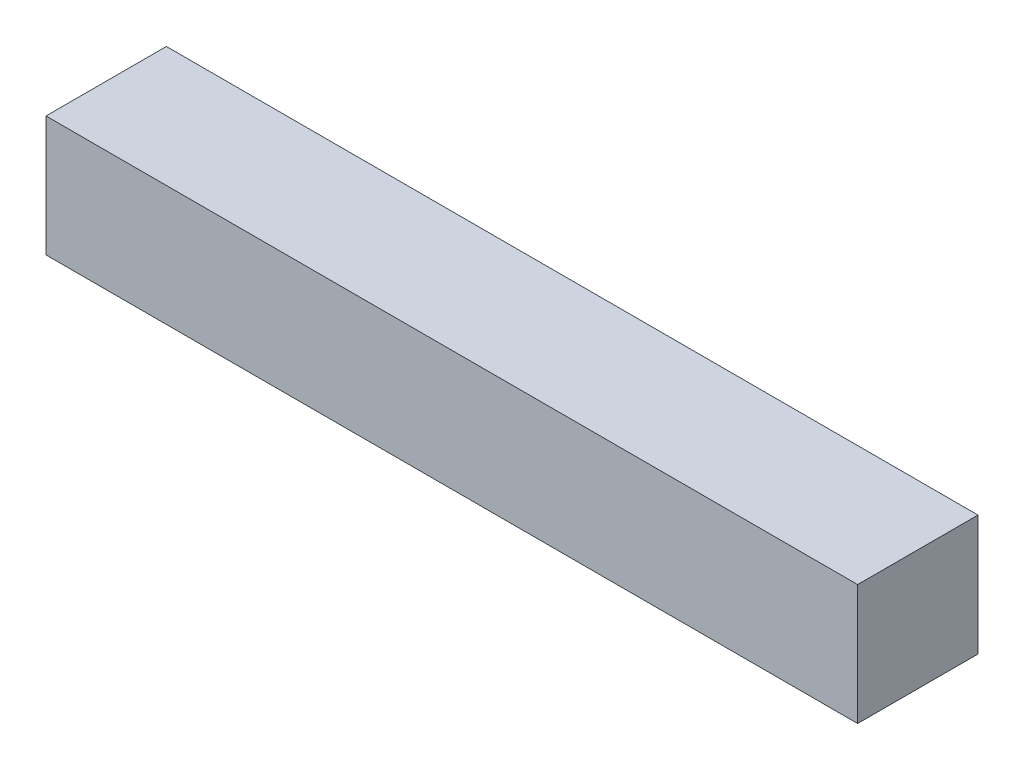
from build123d import *

# Parameters (mm, degrees)
SKETCH1_W           = 5.9
SKETCH1_H           = 0.875
BOSS_EXTRUDE3_DEPTH = 0.875


with BuildPart() as part:
    # Sketch1 → Boss-Extrude3 (new body)
    with BuildSketch(Plane(origin=(0, 0, 0), x_dir=(1, 0, 0), z_dir=(0, 1, 0))):
        with Locations((2.95, -0.4375)):
            Rectangle(SKETCH1_W, SKETCH1_H)
    extrude(amount=BOSS_EXTRUDE3_DEPTH)


solid = part.part
